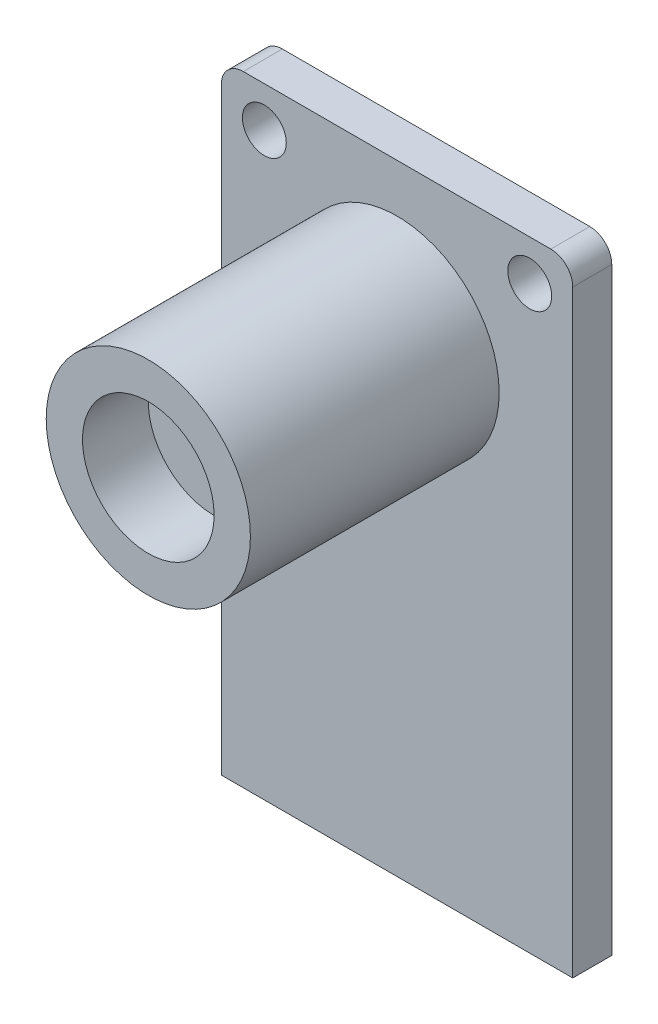
from build123d import *

# Parameters (mm, degrees)
BOSS_EXTRUDE1_DEPTH = 1.78
SKETCH2_R           = 4.655
BOSS_EXTRUDE2_DEPTH = 11.34
SKETCH3_R           = 3
CUT_EXTRUDE1_DEPTH  = 3
SKETCH4_R           = 1
CUT_EXTRUDE2_DEPTH  = 3


with BuildPart() as part:
    # Sketch1 → Boss-Extrude1 (new body)
    with BuildSketch(Plane.XY):
        with BuildLine():
            Line((8.01, -14.14), (-8.01, -14.14))
            Line((-8.01, -14.14), (-8.01, 13.14))
            ThreePointArc((-8.01, 13.14), (-7.717106781, 13.847106781), (-7.01, 14.14))
            Line((-7.01, 14.14), (7.01, 14.14))
            ThreePointArc((7.01, 14.14), (7.717106781, 13.847106781), (8.01, 13.14))
            Line((8.01, 13.14), (8.01, -14.14))
        make_face()
    extrude(amount=BOSS_EXTRUDE1_DEPTH)

    # Sketch2 → Boss-Extrude2 (add)
    with BuildSketch(Plane.XY.offset(1.78)):
        with Locations(Location((0, 7.285, 0), (0, 0, 180))):
            Circle(SKETCH2_R)
    extrude(amount=BOSS_EXTRUDE2_DEPTH)

    # Sketch3 → Cut-Extrude1 (cut)
    with BuildSketch(Plane.XY.offset(13.12)):
        with Locations((0, 7.285)):
            Circle(SKETCH3_R)
    extrude(amount=-CUT_EXTRUDE1_DEPTH, mode=Mode.SUBTRACT)

    # Sketch4 → Cut-Extrude2 (cut)
    with BuildSketch(Plane.XY.offset(1.78)):
        with Locations((6.05, 12.299860012)):
            Circle(SKETCH4_R)
        with Locations((-6.05, 12.299860012)):
            Circle(SKETCH4_R)
    extrude(amount=-CUT_EXTRUDE2_DEPTH, mode=Mode.SUBTRACT)


solid = part.part
